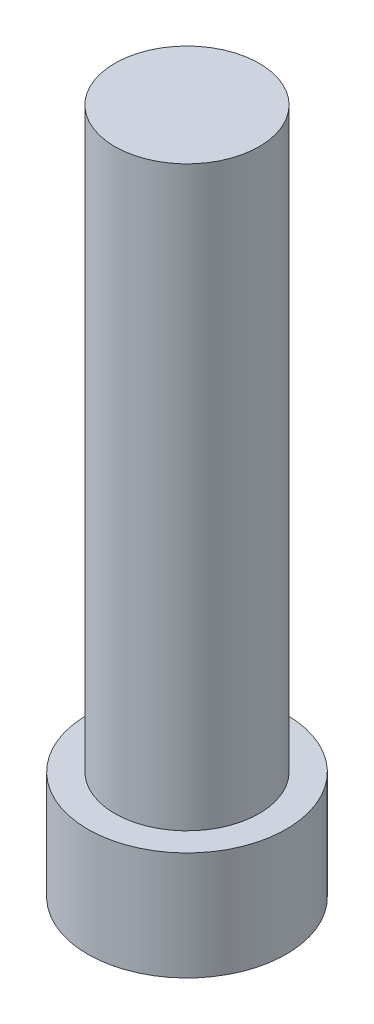
from build123d import *

# Parameters (mm, degrees)
SKETCH_1_R          = 2.75
EXTRUDE_1_DEPTH     = 3
SKETCH_2_R          = 2
EXTRUDE_2_DEPTH     = 16
CUT_EXTRUDE_1_DEPTH = 1.5


with BuildPart() as part:
    # 草图1 → 凸台-拉伸1 (new body)
    with BuildSketch(Plane(origin=(0, 0, 0), x_dir=(1, 0, 0), z_dir=(0, 1, 0))):
        with Locations(Location((0, 0, 0), (0, 0, 270))):
            Circle(SKETCH_1_R)
    extrude(amount=EXTRUDE_1_DEPTH)

    # 草图2 → 凸台-拉伸2 (add)
    with BuildSketch(Plane(origin=(0, 3, 0), x_dir=(1, 0, 0), z_dir=(0, 1, 0))):
        with Locations(Location((0, 0, 0), (0, 0, 270))):
            Circle(SKETCH_2_R)
    extrude(amount=EXTRUDE_2_DEPTH)

    # 草图3 → 切除-拉伸1 (cut)
    with BuildSketch(Plane.XZ):
        Polygon((1.091681609, -0.944226984), (1.36356536, 0.473310514), (0.271883751, 1.417537498), (-1.091681609, 0.944226984), (-1.36356536, -0.473310514), (-0.271883751, -1.417537498), align=None)
    extrude(amount=-CUT_EXTRUDE_1_DEPTH, mode=Mode.SUBTRACT)


solid = part.part
